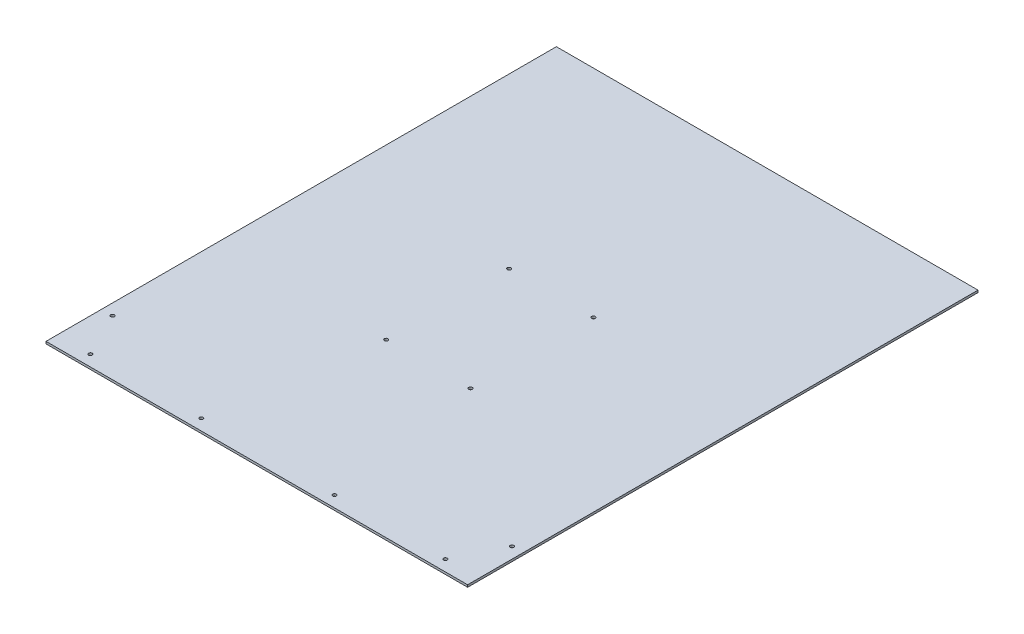
from build123d import *

# Parameters (mm, degrees)
SKETCH1_W           = 950
SKETCH1_H           = 1150
BOSS_EXTRUDE1_DEPTH = 5
SKETCH2_R           = 4
CUT_EXTRUDE1_DEPTH  = 746.838454359
SKETCH3_R           = 4
CUT_EXTRUDE2_DEPTH  = 10


with BuildPart() as part:
    # Sketch1 → Boss-Extrude1 (new body)
    with BuildSketch(Plane(origin=(0, 0, 0), x_dir=(1, 0, 0), z_dir=(0, 1, 0))):
        Rectangle(SKETCH1_W, SKETCH1_H)
    extrude(amount=BOSS_EXTRUDE1_DEPTH)

    # Sketch2 → Cut-Extrude1 (cut, through all)
    with BuildSketch(Plane(origin=(0, 5, 0), x_dir=(1, 0, 0), z_dir=(0, 1, 0))):
        with Locations(Location((95, 88.5, 0), (0, 0, 270))):
            Circle(SKETCH2_R)
        with Locations(Location((-95, 88.5, 0), (0, 0, 90))):
            Circle(SKETCH2_R)
        with Locations(Location((95, -188.5, 0), (0, 0, 90))):
            Circle(SKETCH2_R)
        with Locations(Location((-95, -188.5, 0), (0, 0, 270))):
            Circle(SKETCH2_R)
    extrude(amount=-CUT_EXTRUDE1_DEPTH, mode=Mode.SUBTRACT)

    # Sketch3 → Cut-Extrude2 (cut)
    with BuildSketch(Plane.XZ):
        with Locations(Location((-400, 550, 0), (0, 0, 270))):
            Circle(SKETCH3_R)
        with Locations(Location((-450, 450, 0), (0, 0, 270))):
            Circle(SKETCH3_R)
        with Locations(Location((-150, 550, 0), (0, 0, 270))):
            Circle(SKETCH3_R)
        with Locations(Location((450, 450, 0), (0, 0, 90))):
            Circle(SKETCH3_R)
        with Locations(Location((150, 550, 0), (0, 0, 90))):
            Circle(SKETCH3_R)
        with Locations(Location((400, 550, 0), (0, 0, 90))):
            Circle(SKETCH3_R)
    extrude(amount=-CUT_EXTRUDE2_DEPTH, mode=Mode.SUBTRACT)


solid = part.part
